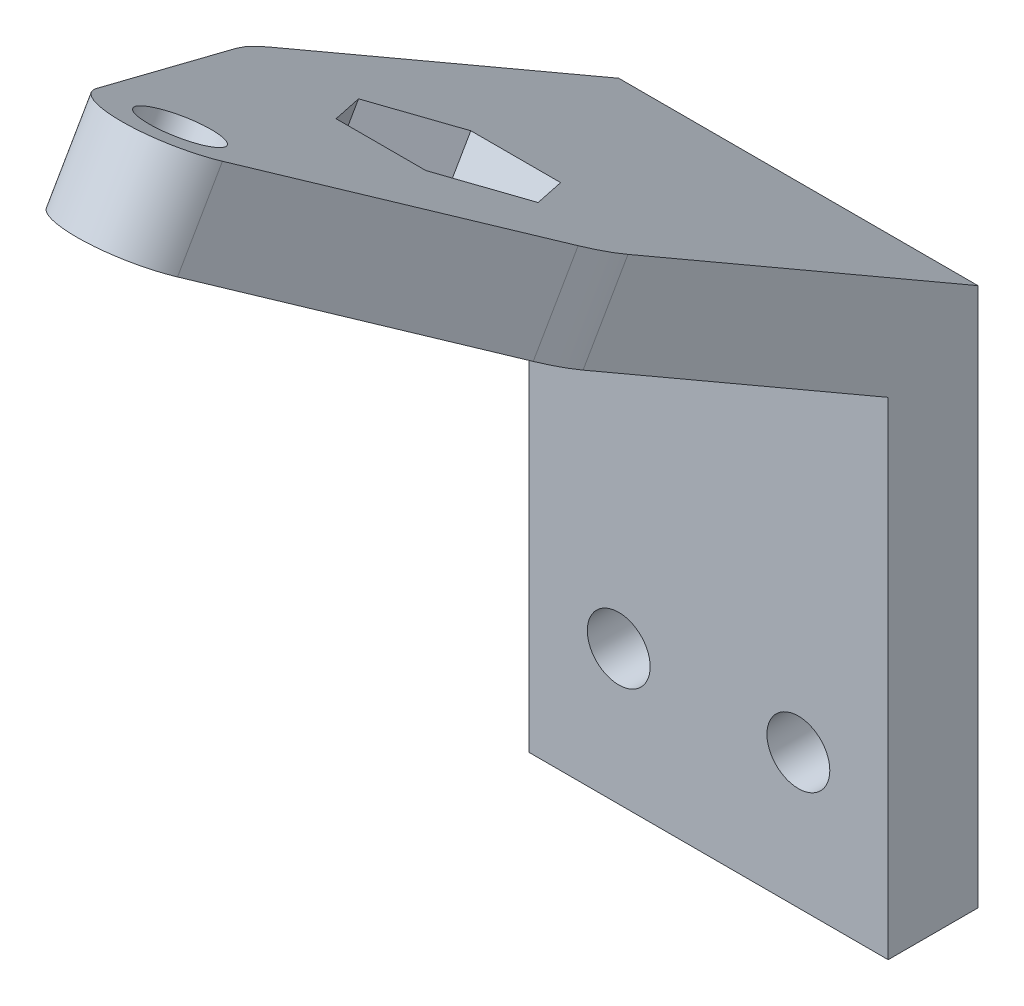
from build123d import *

# Parameters (mm, degrees)
EXTRUDE_THIN1_DEPTH = 20
CUT_EXTRUDE1_REACH  = 104.251
SKETCH2_R           = 3.5
CUT_EXTRUDE9_DEPTH  = 10
SKETCH6_R           = 4
CUT_EXTRUDE10_DEPTH = 10


with BuildPart() as part:
    # Sketch1 → Extrude-Thin1 (new, symmetric)
    with BuildSketch(Plane(origin=(0, 0, 0), x_dir=(0, 0, -1), z_dir=(1, 0, 0))):
        Polygon((0, -60), (0, 0), (-75.344210129, 43.5), (-80.344210129, 34.839745962), (-10, -5.773502692), (-10, -60), align=None)
    extrude(amount=EXTRUDE_THIN1_DEPTH, both=True)

    # Sketch2 → Cut-Extrude1 (cut, up to next)
    with BuildSketch(Plane(origin=(0, 0, 0), x_dir=(-1, 0, 0), z_dir=(0, 0, -1)), mode=Mode.PRIVATE) as cut_extrude1_sk1:
        with Locations((-10, -45)):
            Circle(SKETCH2_R)
    cut_extrude1_tool1 = extrude(cut_extrude1_sk1.sketch, amount=-CUT_EXTRUDE1_REACH, mode=Mode.PRIVATE) & part.part
    # Sketch2 → Cut-Extrude1 (cut, up to next)
    with BuildSketch(Plane(origin=(0, 0, 0), x_dir=(-1, 0, 0), z_dir=(0, 0, -1)), mode=Mode.PRIVATE) as cut_extrude1_sk2:
        with Locations(Location((10, -45, 0), (0, 0, 180))):
            Circle(SKETCH2_R)
    cut_extrude1_tool2 = extrude(cut_extrude1_sk2.sketch, amount=-CUT_EXTRUDE1_REACH, mode=Mode.PRIVATE) & part.part
    add(cut_extrude1_tool1.solids().sort_by_distance((10, -45, 0))[0], mode=Mode.SUBTRACT)
    add(cut_extrude1_tool2.solids().sort_by_distance((-10, -45, 0))[0], mode=Mode.SUBTRACT)

    # Sketch3 → Cut-Extrude9 (cut)
    with BuildSketch(Plane(origin=(0, 0, 0), x_dir=(1, 0, 0), z_dir=(0, 0.8660254037844398, -0.499999999999998))):
        Polygon((29.732274902, -45), (20, -45), (20, -87), (9.8e-08, -87), (-20, -87), (-20, -45), (-32.034408351, -45), (-32.034408351, -100.781822996), (29.732274902, -100.781822996), align=None)
        with BuildLine():
            ThreePointArc((-19.034409454, -50.29484195), (-19.756628033, -47.691083257), (-20, -45))
            Line((-20, -45), (-20, -87))
            Line((-20, -87), (9.8e-08, -87))
            ThreePointArc((9.8e-08, -87), (-4.265814225, -85.668697512), (-7.017204727, -82.147420975))
            Line((-7.017204727, -82.147420975), (-19.034409454, -50.29484195))
        make_face()
        with BuildLine():
            Line((20, -87), (20, -45))
            ThreePointArc((20, -45), (19.756628033, -47.691083257), (19.034409454, -50.29484195))
            Line((19.034409454, -50.29484195), (7.017204727, -82.147420975))
            ThreePointArc((7.017204727, -82.147420975), (4.265814305, -85.668697457), (9.8e-08, -87))
            Line((9.8e-08, -87), (20, -87))
        make_face()
    extrude(amount=-CUT_EXTRUDE9_DEPTH, mode=Mode.SUBTRACT)

    # Sketch6 → Cut-Extrude10 (cut)
    with BuildSketch(Plane(origin=(0, 0, 0), x_dir=(1, 0, 0), z_dir=(0, 0.8660254037844398, -0.499999999999998))):
        with Locations(Location((0, -79.5, 0), (0, 0, 270))):
            Circle(SKETCH6_R)
        Polygon((10, -45), (5, -36.339745962), (-5, -36.339745962), (-10, -45), (-5, -53.660254038), (5, -53.660254038), align=None)
    extrude(amount=-CUT_EXTRUDE10_DEPTH, mode=Mode.SUBTRACT)


solid = part.part
